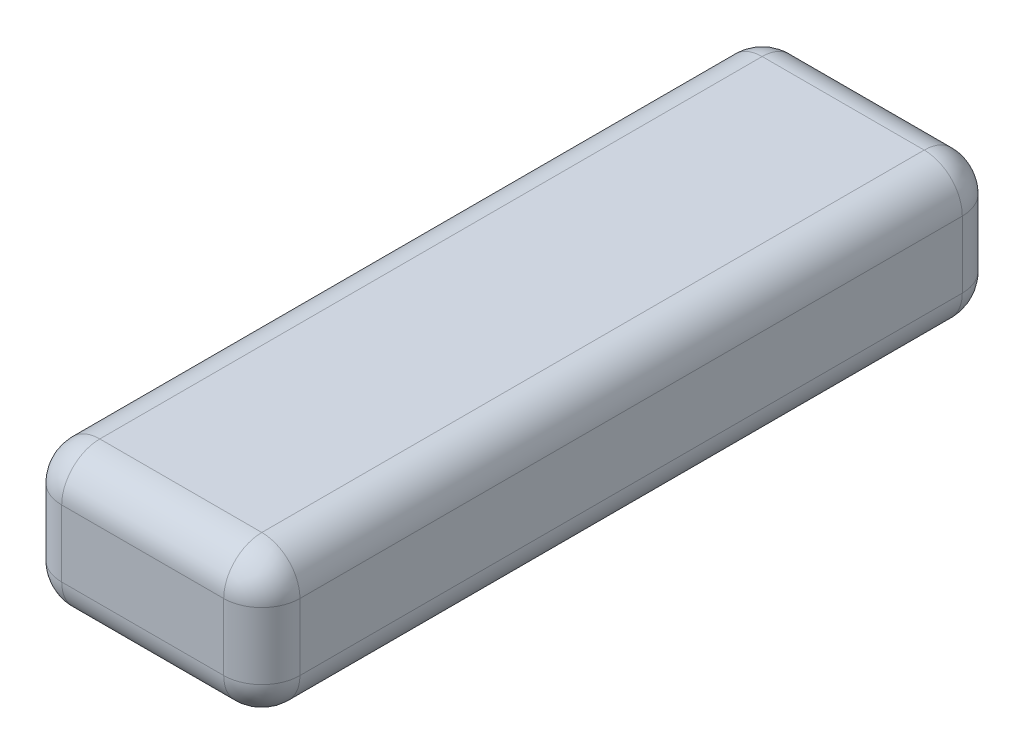
from build123d import *

# Parameters (mm, degrees)
ESQUISSE1_W        = 50
ESQUISSE1_H        = 30
BOSS_EXTRU_1_DEPTH = 155
CONG_1_R           = 8


with BuildPart() as part:
    # Esquisse1 → Boss.-Extru.1 (new body)
    with BuildSketch(Plane.XY):
        Rectangle(ESQUISSE1_W, ESQUISSE1_H)
    extrude(amount=BOSS_EXTRU_1_DEPTH)

    # Congé1
    cong_1_edges = [part.edges().sort_by_distance(p)[0] for p in [
        (25, 0, 155),
        (0, 15, 155),
        (-25, 0, 155),
        (0, 15, 0),
        (25, 0, 0),
        (0, -15, 0),
        (-25, 0, 0),
        (0, -15, 155),
        (-25, 15, 77.5),
        (25, 15, 77.5),
        (25, -15, 77.5),
        (-25, -15, 77.5),
    ]]
    fillet(cong_1_edges, radius=CONG_1_R)


solid = part.part
